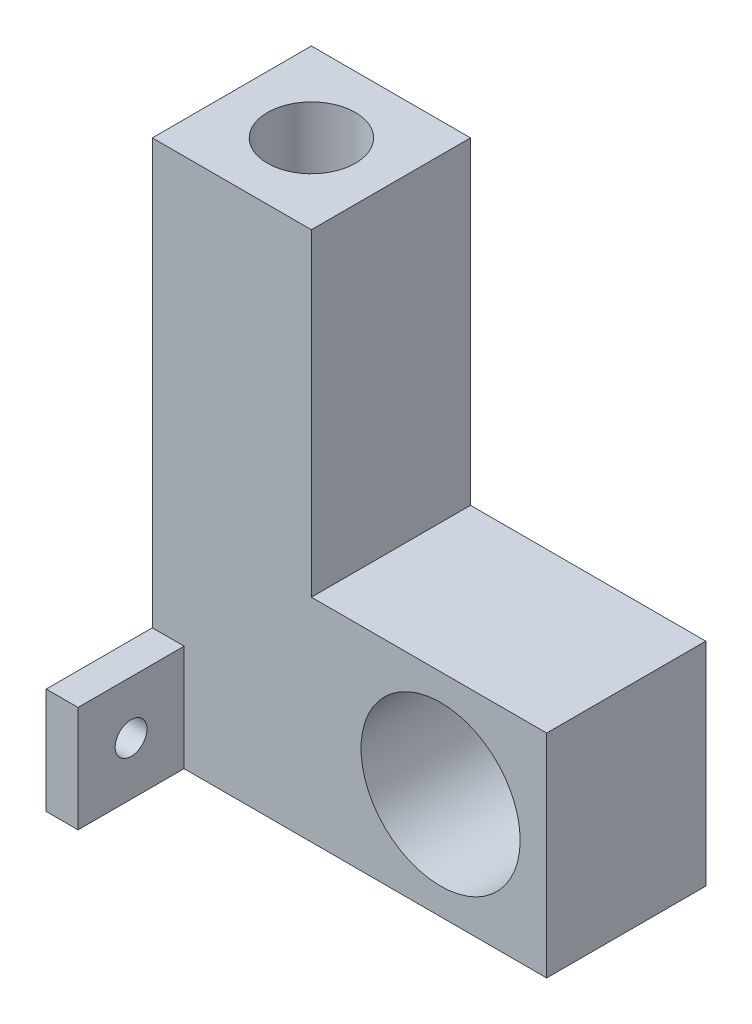
from build123d import *

# Parameters (mm, degrees)
SKETCH1_R           = 7.5
BOSS_EXTRUDE1_DEPTH = 15
SKETCH2_R           = 4.15
CUT_EXTRUDE1_DEPTH  = 59.853707622
SKETCH3_W           = 35
SKETCH3_H           = 10
SKETCH3_R           = 1.5
BOSS_EXTRUDE2_DEPTH = 3


with BuildPart() as part:
    # Sketch1 → Boss-Extrude1 (new body)
    with BuildSketch(Plane.XY):
        Polygon((-12.180119589, 10), (-12.180119589, 40), (-27.180119589, 40), (-27.180119589, -10), (10, -10), (10, 10), align=None)
        Circle(SKETCH1_R, mode=Mode.SUBTRACT)
    extrude(amount=BOSS_EXTRUDE1_DEPTH)

    # Sketch2 → Cut-Extrude1 (cut, through all)
    with BuildSketch(Plane(origin=(0, 40, 0), x_dir=(1, 0, 0), z_dir=(0, 1, 0))):
        with Locations(Location((-19.680119589, -7.5, 0), (0, 0, 270))):
            Circle(SKETCH2_R)
    extrude(amount=-CUT_EXTRUDE1_DEPTH, mode=Mode.SUBTRACT)

    # Sketch3 → Boss-Extrude2 (add)
    with BuildSketch(Plane.ZY.offset(27.180119589)):
        with Locations((7.5, -5)):
            Rectangle(SKETCH3_W, SKETCH3_H)
        with Locations((-5, -5)):
            Circle(SKETCH3_R, mode=Mode.SUBTRACT)
        with Locations((20, -5)):
            Circle(SKETCH3_R, mode=Mode.SUBTRACT)
    extrude(amount=-BOSS_EXTRUDE2_DEPTH)


solid = part.part
